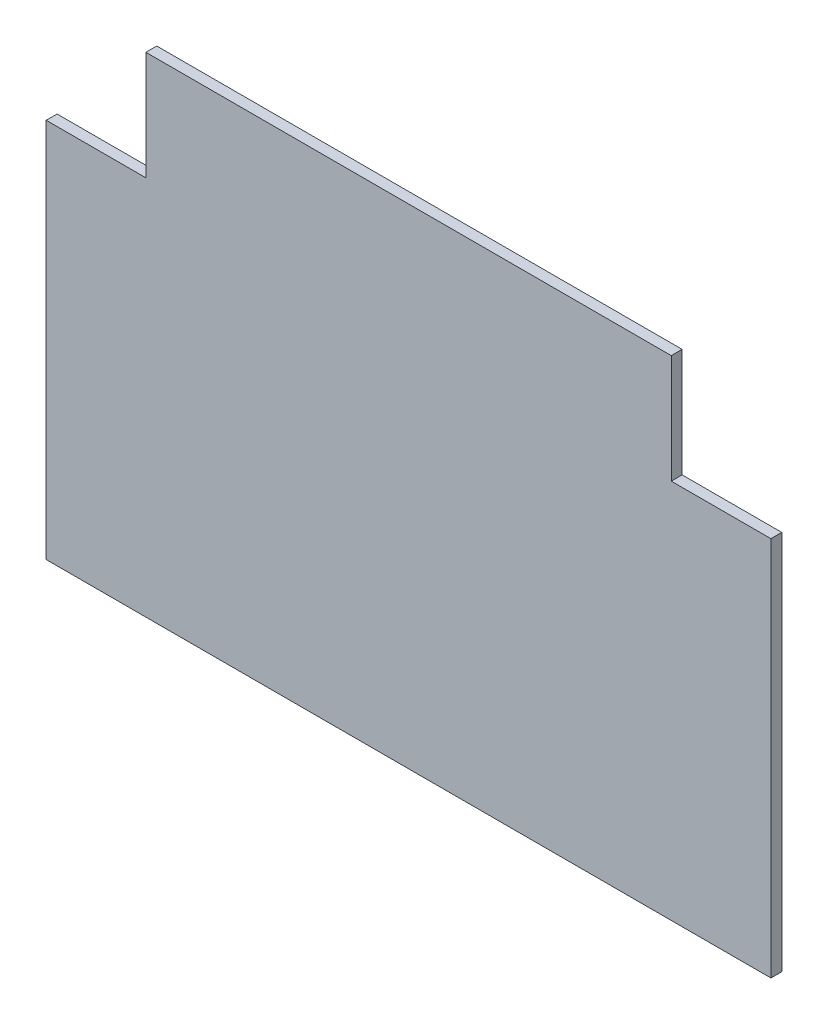
from build123d import *

# Parameters (mm, degrees)
SKETCH1_W           = 400
SKETCH1_H           = 270
BOSS_EXTRUDE1_DEPTH = 6
SKETCH2_W           = 55
SKETCH2_H           = 60
CUT_EXTRUDE1_DEPTH  = 40


with BuildPart() as part:
    # Sketch1 → Boss-Extrude1 (new body)
    with BuildSketch(Plane.XY):
        with Locations((89.131383381, 125.666802076)):
            Rectangle(SKETCH1_W, SKETCH1_H)
    extrude(amount=BOSS_EXTRUDE1_DEPTH)

    # Sketch2 → Cut-Extrude1 (cut)
    with BuildSketch(Plane(origin=(0, 0, 0), x_dir=(-1, 0, 0), z_dir=(0, 0, -1))):
        with Locations((-261.631383381, 230.666802076)):
            Rectangle(SKETCH2_W, SKETCH2_H)
        with Locations((83.368616619, 230.666802076)):
            Rectangle(SKETCH2_W, SKETCH2_H)
    extrude(amount=-CUT_EXTRUDE1_DEPTH, mode=Mode.SUBTRACT)


solid = part.part
